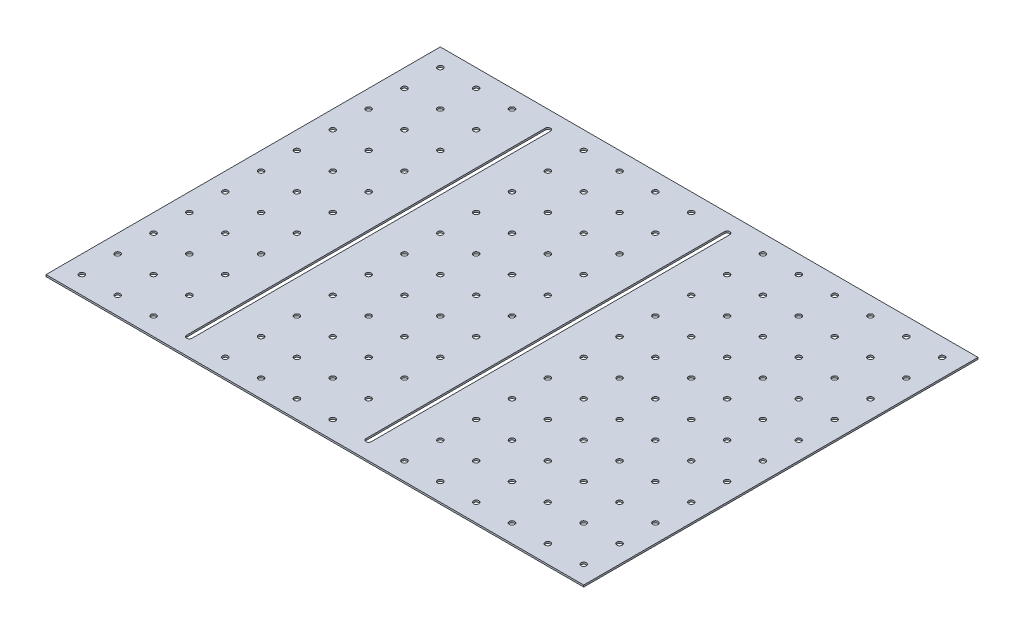
from build123d import *

# Parameters (mm, degrees)
SKETCH1_W           = 300
SKETCH1_H           = 220
BOSS_EXTRUDE1_DEPTH = 1
SKETCH2_R           = 1.5
CUT_EXTRUDE1_DEPTH  = 10
CUT_EXTRUDE2_START  = -1.000001
CUT_EXTRUDE2_DEPTH  = 1.000002
CUT_EXTRUDE3_START  = -1.000001
CUT_EXTRUDE3_DEPTH  = 1.000002


with BuildPart() as part:
    # Sketch1 → Boss-Extrude1 (new body)
    with BuildSketch(Plane(origin=(0, 0, 0), x_dir=(1, 0, 0), z_dir=(0, 1, 0))):
        with Locations((-150, 110)):
            Rectangle(SKETCH1_W, SKETCH1_H)
    extrude(amount=BOSS_EXTRUDE1_DEPTH)

    # Sketch2 → Cut-Extrude1 (cut)
    with BuildSketch(Plane(origin=(0, 1, 0), x_dir=(1, 0, 0), z_dir=(0, 1, 0))):
        with Locations(Location((-290, 210, 0), (0, 0, 270))):
            Circle(SKETCH2_R)
        with Locations(Location((-270, 210, 0), (0, 0, 270))):
            Circle(SKETCH2_R)
        with Locations(Location((-250, 210, 0), (0, 0, 270))):
            Circle(SKETCH2_R)
        with Locations(Location((-230, 210, 0), (0, 0, 270))):
            Circle(SKETCH2_R)
        with Locations(Location((-210, 210, 0), (0, 0, 270))):
            Circle(SKETCH2_R)
        with Locations(Location((-190, 210, 0), (0, 0, 270))):
            Circle(SKETCH2_R)
        with Locations(Location((-170, 210, 0), (0, 0, 270))):
            Circle(SKETCH2_R)
        with Locations(Location((-150, 210, 0), (0, 0, 270))):
            Circle(SKETCH2_R)
        with Locations(Location((-130, 210, 0), (0, 0, 270))):
            Circle(SKETCH2_R)
        with Locations(Location((-110, 210, 0), (0, 0, 270))):
            Circle(SKETCH2_R)
        with Locations(Location((-90, 210, 0), (0, 0, 270))):
            Circle(SKETCH2_R)
        with Locations(Location((-70, 210, 0), (0, 0, 270))):
            Circle(SKETCH2_R)
        with Locations(Location((-50, 210, 0), (0, 0, 270))):
            Circle(SKETCH2_R)
        with Locations(Location((-30, 210, 0), (0, 0, 270))):
            Circle(SKETCH2_R)
        with Locations(Location((-10, 210, 0), (0, 0, 270))):
            Circle(SKETCH2_R)
        with Locations(Location((-290, 190, 0), (0, 0, 270))):
            Circle(SKETCH2_R)
        with Locations(Location((-270, 190, 0), (0, 0, 270))):
            Circle(SKETCH2_R)
        with Locations(Location((-250, 190, 0), (0, 0, 270))):
            Circle(SKETCH2_R)
        with Locations(Location((-230, 190, 0), (0, 0, 270))):
            Circle(SKETCH2_R)
        with Locations(Location((-210, 190, 0), (0, 0, 270))):
            Circle(SKETCH2_R)
        with Locations(Location((-190, 190, 0), (0, 0, 270))):
            Circle(SKETCH2_R)
        with Locations(Location((-170, 190, 0), (0, 0, 270))):
            Circle(SKETCH2_R)
        with Locations(Location((-150, 190, 0), (0, 0, 270))):
            Circle(SKETCH2_R)
        with Locations(Location((-130, 190, 0), (0, 0, 270))):
            Circle(SKETCH2_R)
        with Locations(Location((-110, 190, 0), (0, 0, 270))):
            Circle(SKETCH2_R)
        with Locations(Location((-90, 190, 0), (0, 0, 270))):
            Circle(SKETCH2_R)
        with Locations(Location((-70, 190, 0), (0, 0, 270))):
            Circle(SKETCH2_R)
        with Locations(Location((-50, 190, 0), (0, 0, 270))):
            Circle(SKETCH2_R)
        with Locations(Location((-30, 190, 0), (0, 0, 270))):
            Circle(SKETCH2_R)
        with Locations(Location((-10, 190, 0), (0, 0, 270))):
            Circle(SKETCH2_R)
        with Locations(Location((-290, 170, 0), (0, 0, 270))):
            Circle(SKETCH2_R)
        with Locations(Location((-270, 170, 0), (0, 0, 270))):
            Circle(SKETCH2_R)
        with Locations(Location((-250, 170, 0), (0, 0, 270))):
            Circle(SKETCH2_R)
        with Locations(Location((-230, 170, 0), (0, 0, 270))):
            Circle(SKETCH2_R)
        with Locations(Location((-210, 170, 0), (0, 0, 270))):
            Circle(SKETCH2_R)
        with Locations(Location((-190, 170, 0), (0, 0, 270))):
            Circle(SKETCH2_R)
        with Locations(Location((-170, 170, 0), (0, 0, 270))):
            Circle(SKETCH2_R)
        with Locations(Location((-150, 170, 0), (0, 0, 270))):
            Circle(SKETCH2_R)
        with Locations(Location((-130, 170, 0), (0, 0, 270))):
            Circle(SKETCH2_R)
        with Locations(Location((-110, 170, 0), (0, 0, 270))):
            Circle(SKETCH2_R)
        with Locations(Location((-90, 170, 0), (0, 0, 270))):
            Circle(SKETCH2_R)
        with Locations(Location((-70, 170, 0), (0, 0, 270))):
            Circle(SKETCH2_R)
        with Locations(Location((-50, 170, 0), (0, 0, 270))):
            Circle(SKETCH2_R)
        with Locations(Location((-30, 170, 0), (0, 0, 270))):
            Circle(SKETCH2_R)
        with Locations(Location((-10, 170, 0), (0, 0, 270))):
            Circle(SKETCH2_R)
        with Locations(Location((-290, 150, 0), (0, 0, 270))):
            Circle(SKETCH2_R)
        with Locations(Location((-270, 150, 0), (0, 0, 270))):
            Circle(SKETCH2_R)
        with Locations(Location((-250, 150, 0), (0, 0, 270))):
            Circle(SKETCH2_R)
        with Locations(Location((-230, 150, 0), (0, 0, 270))):
            Circle(SKETCH2_R)
        with Locations(Location((-210, 150, 0), (0, 0, 270))):
            Circle(SKETCH2_R)
        with Locations(Location((-190, 150, 0), (0, 0, 270))):
            Circle(SKETCH2_R)
        with Locations(Location((-170, 150, 0), (0, 0, 270))):
            Circle(SKETCH2_R)
        with Locations(Location((-150, 150, 0), (0, 0, 270))):
            Circle(SKETCH2_R)
        with Locations(Location((-130, 150, 0), (0, 0, 270))):
            Circle(SKETCH2_R)
        with Locations(Location((-110, 150, 0), (0, 0, 270))):
            Circle(SKETCH2_R)
        with Locations(Location((-90, 150, 0), (0, 0, 270))):
            Circle(SKETCH2_R)
        with Locations(Location((-70, 150, 0), (0, 0, 270))):
            Circle(SKETCH2_R)
        with Locations(Location((-50, 150, 0), (0, 0, 270))):
            Circle(SKETCH2_R)
        with Locations(Location((-30, 150, 0), (0, 0, 270))):
            Circle(SKETCH2_R)
        with Locations(Location((-10, 150, 0), (0, 0, 270))):
            Circle(SKETCH2_R)
        with Locations(Location((-290, 130, 0), (0, 0, 270))):
            Circle(SKETCH2_R)
        with Locations(Location((-270, 130, 0), (0, 0, 270))):
            Circle(SKETCH2_R)
        with Locations(Location((-250, 130, 0), (0, 0, 270))):
            Circle(SKETCH2_R)
        with Locations(Location((-230, 130, 0), (0, 0, 270))):
            Circle(SKETCH2_R)
        with Locations(Location((-210, 130, 0), (0, 0, 270))):
            Circle(SKETCH2_R)
        with Locations(Location((-190, 130, 0), (0, 0, 270))):
            Circle(SKETCH2_R)
        with Locations(Location((-170, 130, 0), (0, 0, 270))):
            Circle(SKETCH2_R)
        with Locations(Location((-150, 130, 0), (0, 0, 270))):
            Circle(SKETCH2_R)
        with Locations(Location((-130, 130, 0), (0, 0, 270))):
            Circle(SKETCH2_R)
        with Locations(Location((-110, 130, 0), (0, 0, 270))):
            Circle(SKETCH2_R)
        with Locations(Location((-90, 130, 0), (0, 0, 270))):
            Circle(SKETCH2_R)
        with Locations(Location((-70, 130, 0), (0, 0, 270))):
            Circle(SKETCH2_R)
        with Locations(Location((-50, 130, 0), (0, 0, 270))):
            Circle(SKETCH2_R)
        with Locations(Location((-30, 130, 0), (0, 0, 270))):
            Circle(SKETCH2_R)
        with Locations(Location((-10, 130, 0), (0, 0, 270))):
            Circle(SKETCH2_R)
        with Locations(Location((-290, 110, 0), (0, 0, 270))):
            Circle(SKETCH2_R)
        with Locations(Location((-270, 110, 0), (0, 0, 270))):
            Circle(SKETCH2_R)
        with Locations(Location((-250, 110, 0), (0, 0, 270))):
            Circle(SKETCH2_R)
        with Locations(Location((-230, 110, 0), (0, 0, 270))):
            Circle(SKETCH2_R)
        with Locations(Location((-210, 110, 0), (0, 0, 270))):
            Circle(SKETCH2_R)
        with Locations(Location((-190, 110, 0), (0, 0, 270))):
            Circle(SKETCH2_R)
        with Locations(Location((-170, 110, 0), (0, 0, 270))):
            Circle(SKETCH2_R)
        with Locations(Location((-150, 110, 0), (0, 0, 270))):
            Circle(SKETCH2_R)
        with Locations(Location((-130, 110, 0), (0, 0, 270))):
            Circle(SKETCH2_R)
        with Locations(Location((-110, 110, 0), (0, 0, 270))):
            Circle(SKETCH2_R)
        with Locations(Location((-90, 110, 0), (0, 0, 270))):
            Circle(SKETCH2_R)
        with Locations(Location((-70, 110, 0), (0, 0, 270))):
            Circle(SKETCH2_R)
        with Locations(Location((-50, 110, 0), (0, 0, 270))):
            Circle(SKETCH2_R)
        with Locations(Location((-30, 110, 0), (0, 0, 270))):
            Circle(SKETCH2_R)
        with Locations(Location((-10, 110, 0), (0, 0, 270))):
            Circle(SKETCH2_R)
        with Locations(Location((-290, 90, 0), (0, 0, 270))):
            Circle(SKETCH2_R)
        with Locations(Location((-270, 90, 0), (0, 0, 270))):
            Circle(SKETCH2_R)
        with Locations(Location((-250, 90, 0), (0, 0, 270))):
            Circle(SKETCH2_R)
        with Locations(Location((-230, 90, 0), (0, 0, 270))):
            Circle(SKETCH2_R)
        with Locations(Location((-210, 90, 0), (0, 0, 270))):
            Circle(SKETCH2_R)
        with Locations(Location((-190, 90, 0), (0, 0, 270))):
            Circle(SKETCH2_R)
        with Locations(Location((-170, 90, 0), (0, 0, 270))):
            Circle(SKETCH2_R)
        with Locations(Location((-150, 90, 0), (0, 0, 270))):
            Circle(SKETCH2_R)
        with Locations(Location((-130, 90, 0), (0, 0, 270))):
            Circle(SKETCH2_R)
        with Locations(Location((-110, 90, 0), (0, 0, 270))):
            Circle(SKETCH2_R)
        with Locations(Location((-90, 90, 0), (0, 0, 270))):
            Circle(SKETCH2_R)
        with Locations(Location((-70, 90, 0), (0, 0, 270))):
            Circle(SKETCH2_R)
        with Locations(Location((-50, 90, 0), (0, 0, 270))):
            Circle(SKETCH2_R)
        with Locations(Location((-30, 90, 0), (0, 0, 270))):
            Circle(SKETCH2_R)
        with Locations(Location((-10, 90, 0), (0, 0, 270))):
            Circle(SKETCH2_R)
        with Locations(Location((-290, 70, 0), (0, 0, 270))):
            Circle(SKETCH2_R)
        with Locations(Location((-270, 70, 0), (0, 0, 270))):
            Circle(SKETCH2_R)
        with Locations(Location((-250, 70, 0), (0, 0, 270))):
            Circle(SKETCH2_R)
        with Locations(Location((-230, 70, 0), (0, 0, 270))):
            Circle(SKETCH2_R)
        with Locations(Location((-210, 70, 0), (0, 0, 270))):
            Circle(SKETCH2_R)
        with Locations(Location((-190, 70, 0), (0, 0, 270))):
            Circle(SKETCH2_R)
        with Locations(Location((-170, 70, 0), (0, 0, 270))):
            Circle(SKETCH2_R)
        with Locations(Location((-150, 70, 0), (0, 0, 270))):
            Circle(SKETCH2_R)
        with Locations(Location((-130, 70, 0), (0, 0, 270))):
            Circle(SKETCH2_R)
        with Locations(Location((-110, 70, 0), (0, 0, 270))):
            Circle(SKETCH2_R)
        with Locations(Location((-90, 70, 0), (0, 0, 270))):
            Circle(SKETCH2_R)
        with Locations(Location((-70, 70, 0), (0, 0, 270))):
            Circle(SKETCH2_R)
        with Locations(Location((-50, 70, 0), (0, 0, 270))):
            Circle(SKETCH2_R)
        with Locations(Location((-30, 70, 0), (0, 0, 270))):
            Circle(SKETCH2_R)
        with Locations(Location((-10, 70, 0), (0, 0, 270))):
            Circle(SKETCH2_R)
        with Locations(Location((-290, 50, 0), (0, 0, 270))):
            Circle(SKETCH2_R)
        with Locations(Location((-270, 50, 0), (0, 0, 270))):
            Circle(SKETCH2_R)
        with Locations(Location((-250, 50, 0), (0, 0, 270))):
            Circle(SKETCH2_R)
        with Locations(Location((-230, 50, 0), (0, 0, 270))):
            Circle(SKETCH2_R)
        with Locations(Location((-210, 50, 0), (0, 0, 270))):
            Circle(SKETCH2_R)
        with Locations(Location((-190, 50, 0), (0, 0, 270))):
            Circle(SKETCH2_R)
        with Locations(Location((-170, 50, 0), (0, 0, 270))):
            Circle(SKETCH2_R)
        with Locations(Location((-150, 50, 0), (0, 0, 270))):
            Circle(SKETCH2_R)
        with Locations(Location((-130, 50, 0), (0, 0, 270))):
            Circle(SKETCH2_R)
        with Locations(Location((-110, 50, 0), (0, 0, 270))):
            Circle(SKETCH2_R)
        with Locations(Location((-90, 50, 0), (0, 0, 270))):
            Circle(SKETCH2_R)
        with Locations(Location((-70, 50, 0), (0, 0, 270))):
            Circle(SKETCH2_R)
        with Locations(Location((-50, 50, 0), (0, 0, 270))):
            Circle(SKETCH2_R)
        with Locations(Location((-30, 50, 0), (0, 0, 270))):
            Circle(SKETCH2_R)
        with Locations(Location((-10, 50, 0), (0, 0, 270))):
            Circle(SKETCH2_R)
        with Locations(Location((-290, 30, 0), (0, 0, 270))):
            Circle(SKETCH2_R)
        with Locations(Location((-270, 30, 0), (0, 0, 270))):
            Circle(SKETCH2_R)
        with Locations(Location((-250, 30, 0), (0, 0, 270))):
            Circle(SKETCH2_R)
        with Locations(Location((-230, 30, 0), (0, 0, 270))):
            Circle(SKETCH2_R)
        with Locations(Location((-210, 30, 0), (0, 0, 270))):
            Circle(SKETCH2_R)
        with Locations(Location((-190, 30, 0), (0, 0, 270))):
            Circle(SKETCH2_R)
        with Locations(Location((-170, 30, 0), (0, 0, 270))):
            Circle(SKETCH2_R)
        with Locations(Location((-150, 30, 0), (0, 0, 270))):
            Circle(SKETCH2_R)
        with Locations(Location((-130, 30, 0), (0, 0, 270))):
            Circle(SKETCH2_R)
        with Locations(Location((-110, 30, 0), (0, 0, 270))):
            Circle(SKETCH2_R)
        with Locations(Location((-90, 30, 0), (0, 0, 270))):
            Circle(SKETCH2_R)
        with Locations(Location((-70, 30, 0), (0, 0, 270))):
            Circle(SKETCH2_R)
        with Locations(Location((-50, 30, 0), (0, 0, 270))):
            Circle(SKETCH2_R)
        with Locations(Location((-30, 30, 0), (0, 0, 270))):
            Circle(SKETCH2_R)
        with Locations(Location((-10, 30, 0), (0, 0, 270))):
            Circle(SKETCH2_R)
        with Locations(Location((-290, 10, 0), (0, 0, 270))):
            Circle(SKETCH2_R)
        with Locations(Location((-270, 10, 0), (0, 0, 270))):
            Circle(SKETCH2_R)
        with Locations(Location((-250, 10, 0), (0, 0, 270))):
            Circle(SKETCH2_R)
        with Locations(Location((-230, 10, 0), (0, 0, 270))):
            Circle(SKETCH2_R)
        with Locations(Location((-210, 10, 0), (0, 0, 270))):
            Circle(SKETCH2_R)
        with Locations(Location((-190, 10, 0), (0, 0, 270))):
            Circle(SKETCH2_R)
        with Locations(Location((-170, 10, 0), (0, 0, 270))):
            Circle(SKETCH2_R)
        with Locations(Location((-150, 10, 0), (0, 0, 270))):
            Circle(SKETCH2_R)
        with Locations(Location((-130, 10, 0), (0, 0, 270))):
            Circle(SKETCH2_R)
        with Locations(Location((-110, 10, 0), (0, 0, 270))):
            Circle(SKETCH2_R)
        with Locations(Location((-90, 10, 0), (0, 0, 270))):
            Circle(SKETCH2_R)
        with Locations(Location((-70, 10, 0), (0, 0, 270))):
            Circle(SKETCH2_R)
        with Locations(Location((-50, 10, 0), (0, 0, 270))):
            Circle(SKETCH2_R)
        with Locations(Location((-30, 10, 0), (0, 0, 270))):
            Circle(SKETCH2_R)
        with Locations(Location((-10, 10, 0), (0, 0, 270))):
            Circle(SKETCH2_R)
    extrude(amount=-CUT_EXTRUDE1_DEPTH, mode=Mode.SUBTRACT)

    # Sketch3 → Cut-Extrude2 (cut)
    with BuildSketch(Plane(origin=(0, 1, 0), x_dir=(1, 0, 0), z_dir=(0, 1, 0)).offset(CUT_EXTRUDE2_START)):
        with BuildLine():
            Line((-231.5, 10), (-231.5, 210))
            ThreePointArc((-231.5, 210), (-230, 211.5), (-228.5, 210))
            Line((-228.5, 210), (-228.5, 10))
            ThreePointArc((-228.5, 10), (-230, 8.5), (-231.5, 10))
        make_face()
    extrude(amount=CUT_EXTRUDE2_DEPTH, mode=Mode.SUBTRACT)

    # Sketch4 → Cut-Extrude3 (cut)
    with BuildSketch(Plane(origin=(0, 1, 0), x_dir=(1, 0, 0), z_dir=(0, 1, 0)).offset(CUT_EXTRUDE3_START)):
        with BuildLine():
            Line((-131.5, 10), (-131.5, 210))
            ThreePointArc((-131.5, 210), (-130, 211.5), (-128.5, 210))
            Line((-128.5, 210), (-128.5, 10))
            ThreePointArc((-128.5, 10), (-130, 8.5), (-131.5, 10))
        make_face()
    extrude(amount=CUT_EXTRUDE3_DEPTH, mode=Mode.SUBTRACT)


solid = part.part
